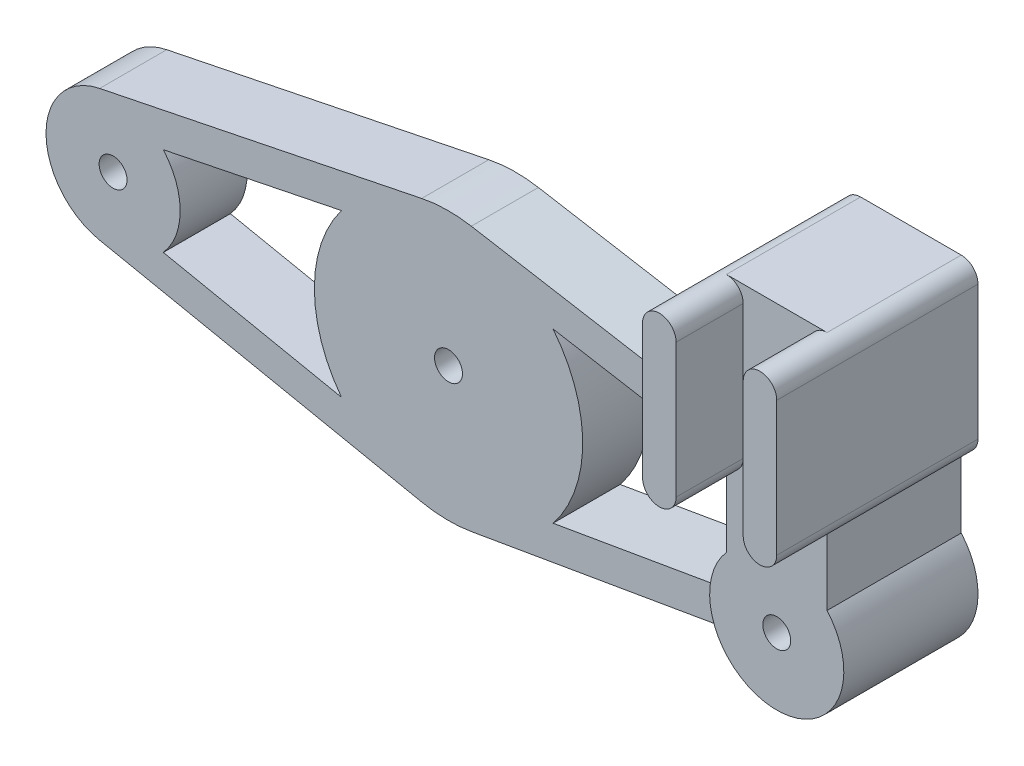
from build123d import *

# Parameters (mm, degrees)
BOSS_EXTRUDE1_DEPTH   = 12
SKETCH5_R             = 12
BOSS_EXTRUDE2_DEPTH   = 12
M6_TAPPED_HOLE1_D     = 5
BOSS_EXTRUDE3_START   = -24
BOSS_EXTRUDE3_DEPTH   = 36
BOSS_EXTRUDE3_2_DEPTH = 36
BOSS_EXTRUDE4_REACH   = 105.625
SKETCH7_W             = 18
SKETCH7_H             = 43.323398588


with BuildPart() as part:
    # Sketch1 → Boss-Extrude1 (new body)
    with BuildSketch(Plane.XY):
        with BuildLine():
            Line((-62.4, 11.757550765), (-4.8, 23.515101531))
            ThreePointArc((-4.8, 23.515101531), (-0.369908928, 23.997149151), (4.07293506, 23.65187519))
            Line((4.07293506, 23.65187519), (72.747145648, 11.825937595))
            ThreePointArc((72.747145648, 11.825937595), (82.710678119, 0), (72.747145648, -11.825937595))
            Line((72.747145648, -11.825937595), (4.07293506, -23.65187519))
            ThreePointArc((4.07293506, -23.65187519), (-0.369908928, -23.997149151), (-4.8, -23.515101531))
            Line((-4.8, -23.515101531), (-62.4, -11.757550765))
            ThreePointArc((-62.4, -11.757550765), (-72, 0), (-62.4, 11.757550765))
        make_face()
        with BuildLine():
            Line((-51.017662351, 7.957236352), (-19.153777676, 14.461424575))
            ThreePointArc((-19.153777676, 14.461424575), (-24, 0), (-19.153777676, -14.461424575))
            Line((-19.153777676, -14.461424575), (-51.017662351, -7.957236352))
            ThreePointArc((-51.017662351, -7.957236352), (-48, 0), (-51.017662351, 7.957236352))
        make_face(mode=Mode.SUBTRACT)
        with BuildLine():
            Line((18.698946243, 15.044913074), (61.487349503, 7.676601412))
            ThreePointArc((61.487349503, 7.676601412), (58.710678119, 0), (61.487349503, -7.676601412))
            Line((61.487349503, -7.676601412), (18.698946243, -15.044913074))
            ThreePointArc((18.698946243, -15.044913074), (24, 0), (18.698946243, 15.044913074))
        make_face(mode=Mode.SUBTRACT)
    extrude(amount=BOSS_EXTRUDE1_DEPTH)

    # Sketch5 → Boss-Extrude2 (add)
    with BuildSketch(Plane.XY.offset(12)):
        with Locations(Location((70.710678119, 0, 0), (0, 0, 140.229295936))):
            Circle(SKETCH5_R)
    extrude(amount=BOSS_EXTRUDE2_DEPTH)

    # M6 Tapped Hole1 (through all)
    with Locations(Plane.XY.offset(24)):
        with Locations((-60, 0), (0, 0), (70.710678119, 0)):
            Hole(M6_TAPPED_HOLE1_D / 2)

    # Boss-Extrude4: up to this face of the body (flat: up to its plane)
    boss_extrude4_end = Plane(part.part.faces().sort_by_distance((79.673131606, -7.459474336, 24))[0])
    # Sketch7 → Boss-Extrude4 (add, up to the picked face)
    with BuildSketch(Plane(origin=(0, 0, 0), x_dir=(-1, 0, 0), z_dir=(0, 0, -1)), mode=Mode.PRIVATE) as boss_extrude4_sk1:
        with Locations((-70.710678119, 29.338300706)):
            Rectangle(SKETCH7_W, SKETCH7_H)
    boss_extrude4_tool1 = split(extrude(boss_extrude4_sk1.sketch, amount=-BOSS_EXTRUDE4_REACH, mode=Mode.PRIVATE), bisect_by=boss_extrude4_end, keep=Keep.BOTH, mode=Mode.PRIVATE)


with BuildPart() as body_2:
    # Sketch6 → Boss-Extrude3 (new body)
    with BuildSketch(Plane.XY.offset(24).offset(BOSS_EXTRUDE3_START)):
        with BuildLine():
            Line((76.710678119, 24), (76.710678119, 48))
            ThreePointArc((76.710678119, 48), (79.710678119, 51), (82.710678119, 48))
            Line((82.710678119, 48), (82.710678119, 24))
            ThreePointArc((82.710678119, 24), (79.710678119, 21), (76.710678119, 24))
        make_face()
    extrude(amount=BOSS_EXTRUDE3_DEPTH)


with BuildPart() as body_3:
    # Sketch6 → Boss-Extrude3 2 (new body)
    with BuildSketch(Plane.XY.offset(24).offset(BOSS_EXTRUDE3_START)):
        with BuildLine():
            Line((58.710678119, 24), (58.710678119, 48))
            ThreePointArc((58.710678119, 48), (61.710678119, 51), (64.710678119, 48))
            Line((64.710678119, 48), (64.710678119, 24))
            ThreePointArc((64.710678119, 24), (61.710678119, 21), (58.710678119, 24))
        make_face()
    extrude(amount=BOSS_EXTRUDE3_2_DEPTH)


with BuildPart() as part_1:
    add(part.part)

    add(body_2.part)  # Boss-Extrude4 merges body 2

    add(body_3.part)  # Boss-Extrude4 merges body 3
    add(boss_extrude4_tool1.solids().sort_by(Axis((70.710678, 29.338301, 0), (0, 0, 1)))[0])


solid = part_1.part
